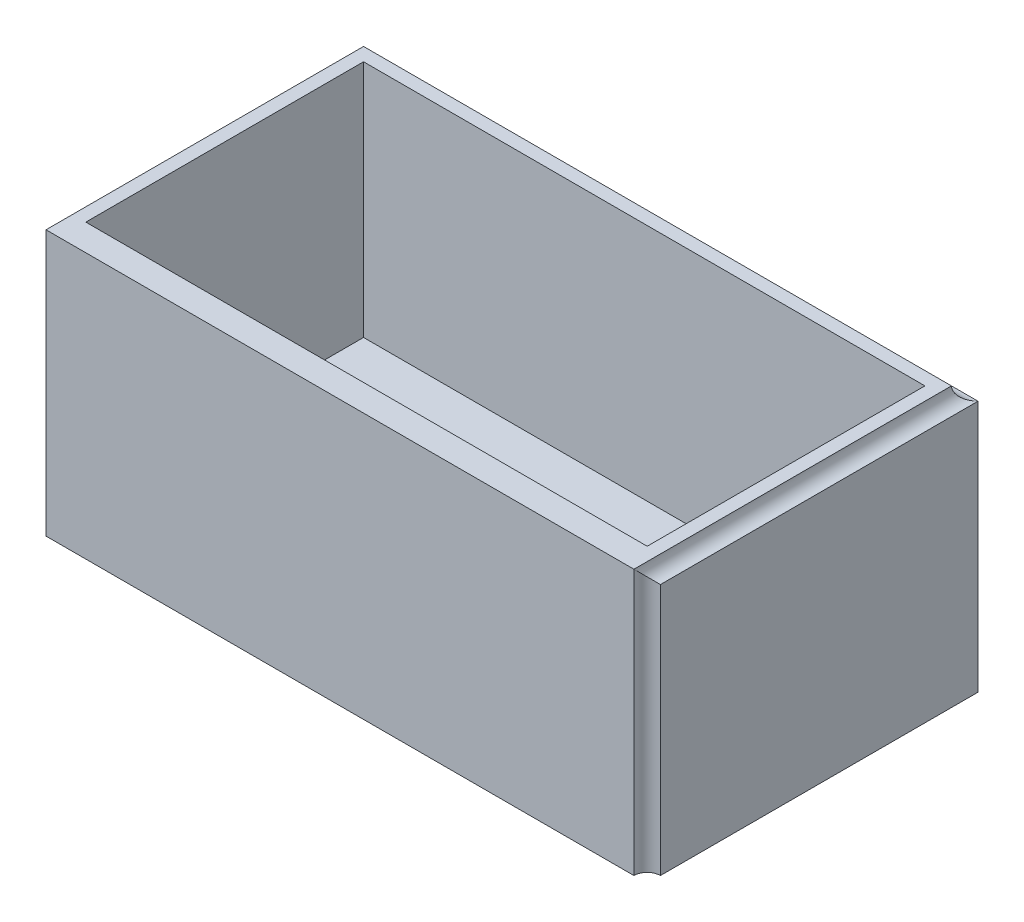
from build123d import *

# Parameters (mm, degrees)
SKETCH_1_W        = 231.607772504
SKETCH_1_H        = 124.691769169
EXTRUDE_1_DEPTH   = 50
SHELL_1_T         = -10
SWEEP_1_PROFILE_R = 5


with BuildPart() as part:
    # 草图1 → 凸台-拉伸1 (new, symmetric)
    with BuildSketch(Plane(origin=(0, 0, 0), x_dir=(1, 0, 0), z_dir=(0, 1, 0))):
        with Locations((-0.653520803, 3.006195692)):
            Rectangle(SKETCH_1_W, SKETCH_1_H)
    extrude(amount=EXTRUDE_1_DEPTH, both=True)

    # 抽壳1
    shell_1_openings = [part.faces().sort_by_distance(p)[0] for p in [
        (-0.653520803, 50, -3.006195693),
    ]]
    offset(amount=SHELL_1_T, openings=shell_1_openings, kind=Kind.INTERSECTION)

    # 切除-扫描1: sweep along a curve in space
    with BuildLine() as sweep_1_path:
        Line((115.150365449, -50, 59.339688892), (115.150365449, 50, 59.339688892))
        Line((115.150365449, 50, 59.339688892), (115.150365449, 50, -65.352080277))
        Line((115.150365449, 50, -65.352080277), (-116.457407055, 50, -65.352080277))
        Line((-116.457407055, 50, -65.352080277), (-116.457407055, 50, 59.339688892))
        Line((-116.457407055, 50, 59.339688892), (-116.457407055, -50, 59.339688892))
    # 切除-扫描1 profile (on start of the path) → 切除-扫描1 (sweep, cut)
    with BuildSketch(Plane(origin=(115.150365449, -50, 59.339688892), x_dir=(0, 0, 1), z_dir=(0, 1, 0))):
        Circle(SWEEP_1_PROFILE_R)
    sweep(path=sweep_1_path.line, transition=Transition.RIGHT, mode=Mode.SUBTRACT)


solid = part.part
